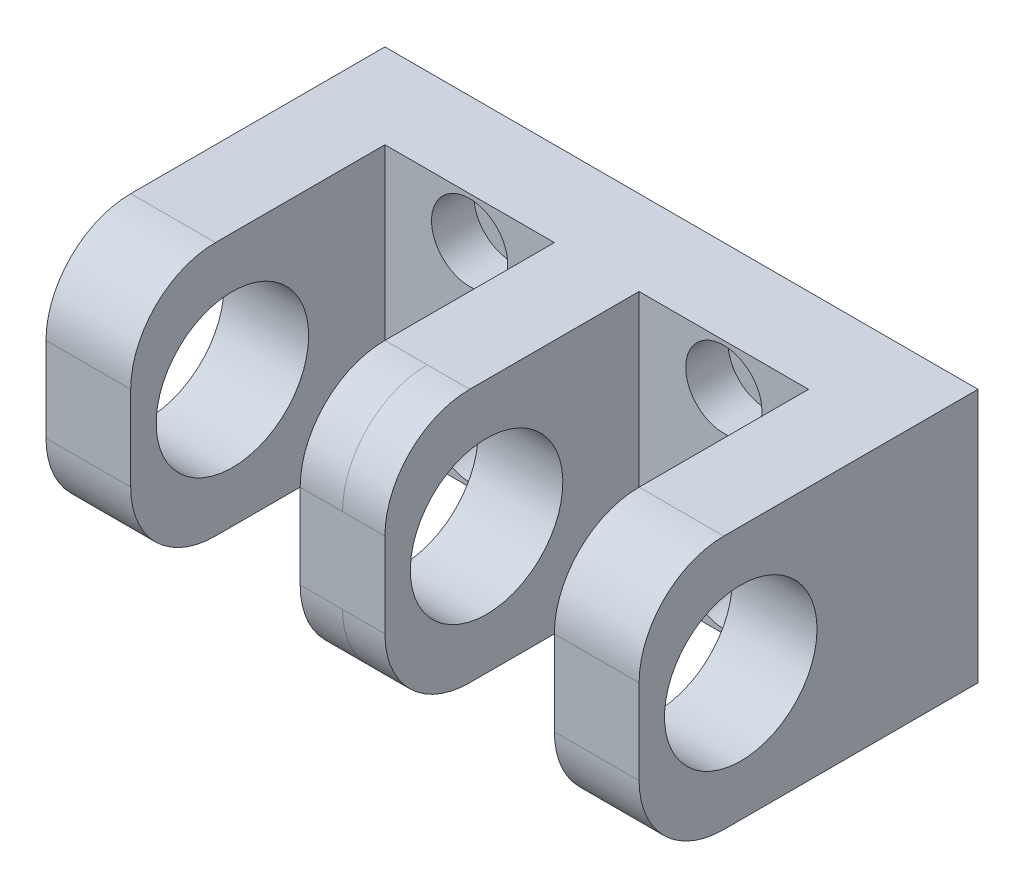
from build123d import *

# Parameters (mm, degrees)
SZKIC1_W                    = 35
SZKIC1_H                    = 30
DODANIE_WYCI_GNI_CIE1_DEPTH = 10
SZKIC2_W                    = 5
SZKIC2_H                    = 30
SZKIC2_W_2                  = 10
DODANIE_WYCI_GNI_CIE2_DEPTH = 30
SZKIC3_R                    = 9
WYTNIJ_WYCI_GNI_CIE1_DEPTH  = 62.032778079
ZAOKR_GLENIE1_R             = 10
ZAOKR_GLENIE1_OF_LUSTRO1_R  = 10
SZKIC4_R                    = 2.5
WYTNIJ_WYCI_GNI_CIE2_DEPTH  = 56
SZKIC5_R                    = 4.5
SZKIC5_R_2                  = 2.5
WYTNIJ_WYCI_GNI_CIE3_DEPTH  = 5


with BuildPart() as part:
    # Szkic1 → Dodanie-wyciągnięcie1 (new body)
    with BuildSketch(Plane.XY):
        with Locations((17.5, 15)):
            Rectangle(SZKIC1_W, SZKIC1_H)
    dodanie_wyci_gni_cie1 = extrude(amount=DODANIE_WYCI_GNI_CIE1_DEPTH)

    # Szkic2 → Dodanie-wyciągnięcie2 (add)
    with BuildSketch(Plane.XY.offset(10)):
        with Locations((2.5, 15)):
            Rectangle(SZKIC2_W, SZKIC2_H)
        with Locations((30, 15)):
            Rectangle(SZKIC2_W_2, SZKIC2_H)
    dodanie_wyci_gni_cie2 = extrude(amount=DODANIE_WYCI_GNI_CIE2_DEPTH)

    # Szkic3 → Wytnij-wyciągnięcie1 (cut, through all)
    with BuildSketch(Plane(origin=(35, 0, 0), x_dir=(0, 0, -1), z_dir=(1, 0, 0))):
        with Locations((-28, 15)):
            Circle(SZKIC3_R)
    wytnij_wyci_gni_cie1 = extrude(amount=-WYTNIJ_WYCI_GNI_CIE1_DEPTH, mode=Mode.SUBTRACT)

    # Zaokrąglenie1
    zaokr_glenie1_edges = [part.edges().sort_by_distance(p)[0] for p in [
        (2.5, 0, 40),
        (2.5, 30, 40),
        (30, 30, 40),
        (30, 0, 40),
    ]]
    fillet(zaokr_glenie1_edges, radius=ZAOKR_GLENIE1_R)

    # Lustro1: Dodanie-wyciągnięcie1, Dodanie-wyciągnięcie2, Wytnij-wyciągnięcie1 across plane
    add(dodanie_wyci_gni_cie1.mirror(Plane(origin=(0, 0, 10), x_dir=(0, 0, 1), z_dir=(1, 0, 0))))
    add(dodanie_wyci_gni_cie2.mirror(Plane(origin=(0, 0, 10), x_dir=(0, 0, 1), z_dir=(1, 0, 0))))
    add(wytnij_wyci_gni_cie1.mirror(Plane(origin=(0, 0, 10), x_dir=(0, 0, 1), z_dir=(1, 0, 0))), mode=Mode.SUBTRACT)

    # Zaokrąglenie1 of Lustro1
    zaokr_glenie1_of_lustro1_edges = [part.edges().sort_by_distance(p)[0] for p in [
        (-2.5, 0, 40),
        (-2.5, 30, 40),
        (-30, 30, 40),
        (-30, 0, 40),
    ]]
    fillet(zaokr_glenie1_of_lustro1_edges, radius=ZAOKR_GLENIE1_OF_LUSTRO1_R)

    # Szkic4 → Wytnij-wyciągnięcie2 (cut, through all)
    with BuildSketch(Plane.XY.offset(10)):
        with Locations((-15, 25)):
            Circle(SZKIC4_R)
        with Locations((15, 25)):
            Circle(SZKIC4_R)
        with Locations((15, 5)):
            Circle(SZKIC4_R)
        with Locations((-15, 5)):
            Circle(SZKIC4_R)
    extrude(amount=-WYTNIJ_WYCI_GNI_CIE2_DEPTH, mode=Mode.SUBTRACT)

    # Szkic5 → Wytnij-wyciągnięcie3 (cut)
    # profile 1 of 4: a face of its own
    with BuildSketch(Plane.XY.offset(10)):
        with Locations((-15, 25)):
            Circle(SZKIC5_R)
        with Locations((-15, 25)):
            Circle(SZKIC5_R_2, mode=Mode.SUBTRACT)
    # profile 2 of 4: a face of its own
    with BuildSketch(Plane.XY.offset(10)):
        with Locations((15, 25)):
            Circle(SZKIC5_R)
        with Locations((15, 25)):
            Circle(SZKIC5_R_2, mode=Mode.SUBTRACT)
    # profile 3 of 4: a face of its own
    with BuildSketch(Plane.XY.offset(10)):
        with Locations((15, 5)):
            Circle(SZKIC5_R)
        with Locations((15, 5)):
            Circle(SZKIC5_R_2, mode=Mode.SUBTRACT)
    # profile 4 of 4: a face of its own
    with BuildSketch(Plane.XY.offset(10)):
        with Locations((-15, 5)):
            Circle(SZKIC5_R)
        with Locations((-15, 5)):
            Circle(SZKIC5_R_2, mode=Mode.SUBTRACT)
    extrude(amount=-WYTNIJ_WYCI_GNI_CIE3_DEPTH, mode=Mode.SUBTRACT)


solid = part.part
